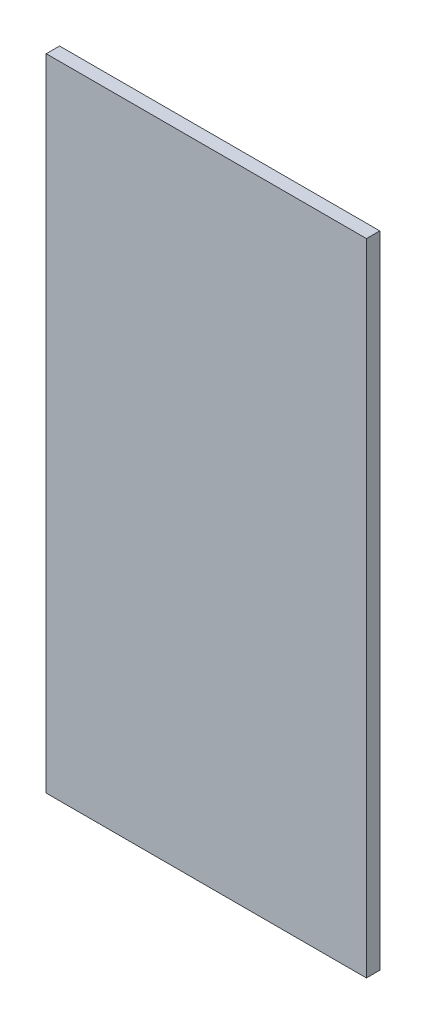
from build123d import *

# Parameters (mm, degrees)
SKETCH2_W           = 304.8
SKETCH2_H           = 609.6
BOSS_EXTRUDE1_DEPTH = 6.35


with BuildPart() as part:
    # Sketch2 → Boss-Extrude1 (new, symmetric)
    with BuildSketch(Plane.XY):
        Rectangle(SKETCH2_W, SKETCH2_H)
    extrude(amount=BOSS_EXTRUDE1_DEPTH, both=True)


solid = part.part
